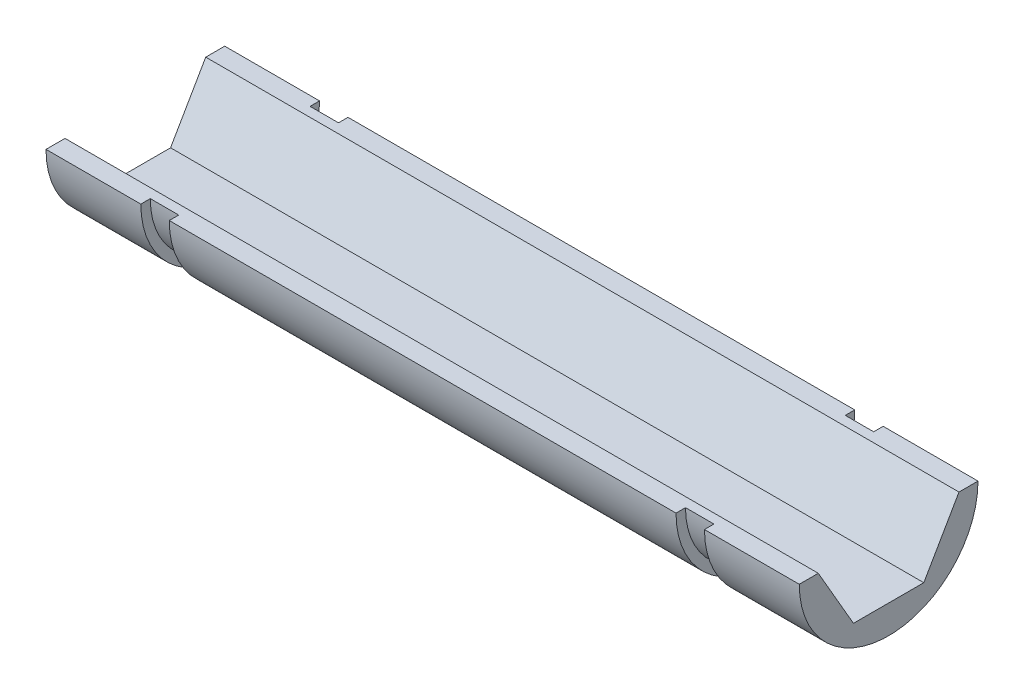
from build123d import *

# Parameters (mm, degrees)
SKETCH1_R           = 9.4262
BOSS_EXTRUDE1_DEPTH = 79.4512
SKETCH2_W           = 3
SKETCH2_H           = 1


with BuildPart() as part:
    # Sketch1 → Boss-Extrude1 (new body)
    with BuildSketch(Plane(origin=(0, 0, 0), x_dir=(0, 0, -1), z_dir=(1, 0, 0))):
        Circle(SKETCH1_R)
        Polygon((7.4203366, 0), (3.7101683, 6.4262), (-3.7101683, 6.4262), (-7.4203366, 0), (-3.7101683, -6.4262), (3.7101683, -6.4262), align=None, mode=Mode.SUBTRACT)
    extrude(amount=BOSS_EXTRUDE1_DEPTH)

    # Sketch2 → Cut-Revolve1 (revolve, cut)
    with BuildSketch(Plane.XY, mode=Mode.PRIVATE) as cut_revolve1_sk:
        with Locations((11.5, 8.9262)):
            Rectangle(SKETCH2_W, SKETCH2_H)
    cut_revolve1 = revolve(cut_revolve1_sk.sketch.rotate(Axis((-1.5494, 0, 0), (1, 0, 0)), 90), axis=Axis((-1.5494, 0, 0), (1, 0, 0)), mode=Mode.SUBTRACT)

    # Mirror1: Cut-Revolve1 across plane
    add(cut_revolve1.mirror(Plane.ZY.offset(-39.7256)), mode=Mode.SUBTRACT)

    # Split1
    split(bisect_by=Plane.ZX, keep=Keep.BOTTOM)


solid = part.part
